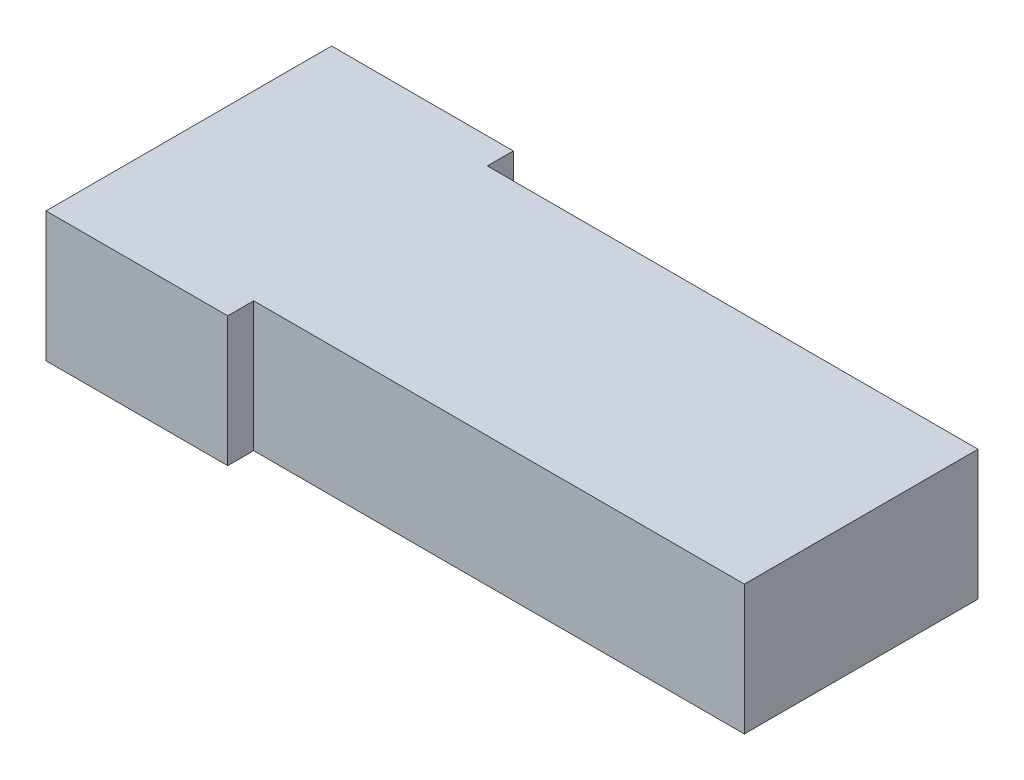
from build123d import *

# Parameters (mm, degrees)
BOSS_EXTRUDE1_DEPTH = 2
BOSS_EXTRUDE2_DEPTH = 3
SKETCH3_W           = 7
SKETCH3_H           = 3.108863517
BOSS_EXTRUDE3_DEPTH = 2


with BuildPart() as part:
    # Sketch1 → Boss-Extrude1 (new body)
    with BuildSketch(Plane(origin=(0, 0, 0), x_dir=(1, 0, 0), z_dir=(0, 1, 0))):
        Polygon((-7.5, -4.5), (7.5, -4.5), (11.4, -4.5), (11.4, 4.5), (7.5, 4.5), (-7.5, 4.5), (-7.5, 5.5), (-14.5, 5.5), (-14.5, -5.5), (-7.5, -5.5), align=None)
    extrude(amount=BOSS_EXTRUDE1_DEPTH)

    # Sketch2 → Boss-Extrude2 (add)
    with BuildSketch(Plane(origin=(0, 0, 0), x_dir=(1, 0, 0), z_dir=(0, 1, 0))):
        Polygon((6.1, 4.5), (-7.5, 4.5), (-7.5, 5.5), (-14.5, 5.5), (-14.5, 3.5), (0.5, 3.5), (0.5, 3), (6.1, 3), align=None)
        Polygon((-7.5, -4.5), (-7.5, -5.5), (-14.5, -5.5), (-14.5, -3.5), (0.5, -3.5), (0.5, -3), (7.5, -3), (9.9, -3), (9.9, 4.5), (11.4, 4.5), (11.4, -4.5), (7.5, -4.5), align=None)
        Polygon((0.5, -1.6), (0.5, 1.6), (7.5, 1.6), (7.5, 4.5), (8.5, 4.5), (8.5, -1.6), (7.5, -1.6), align=None)
    extrude(amount=-BOSS_EXTRUDE2_DEPTH)

    # Sketch3 → Boss-Extrude3 (add)
    with BuildSketch(Plane.XZ.offset(3)):
        with Locations((-11, 3.945568242)):
            Rectangle(SKETCH3_W, SKETCH3_H)
        with Locations((-11, -3.945568242)):
            Rectangle(SKETCH3_W, SKETCH3_H)
    extrude(amount=-BOSS_EXTRUDE3_DEPTH)


solid = part.part
